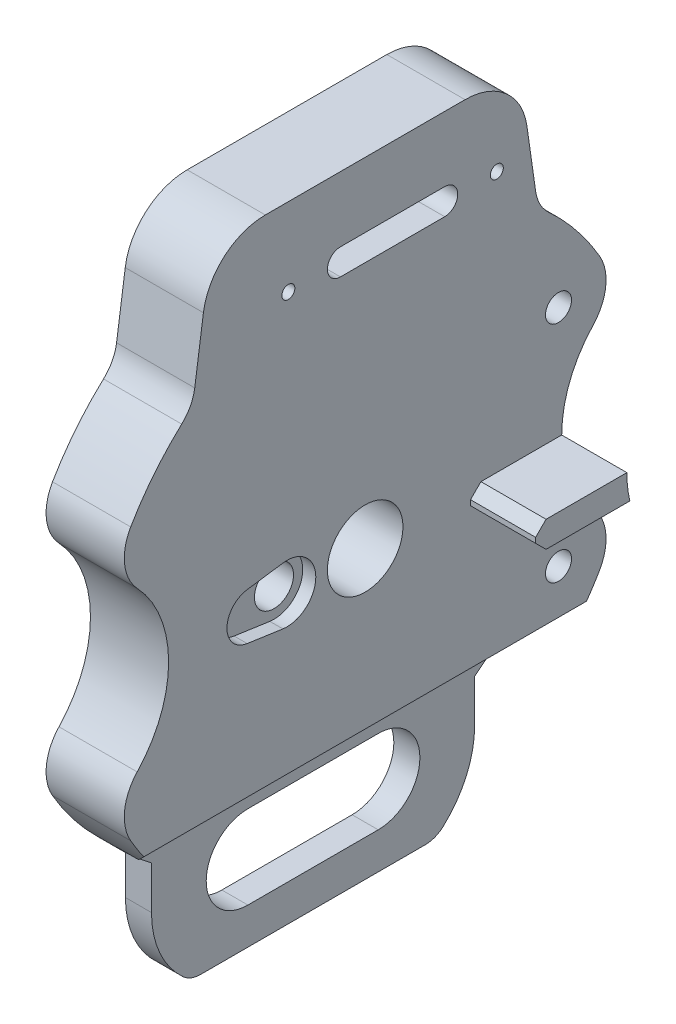
from build123d import *

# Parameters (mm, degrees)
SZKIC1_R                    = 14.5
SZKIC1_R_2                  = 5
DODANIE_WYCI_GNI_CIE1_DEPTH = 15
M6_TAPPED_HOLE1_D           = 5
DODANIE_WYCI_GNI_CIE3_START = -25
DODANIE_WYCI_GNI_CIE3_DEPTH = 25
WYTNIJ_WYCI_GNI_CIE2_DEPTH  = 10
WYTNIJ_WYCI_GNI_CIE4_DEPTH  = 20
SFAZOWANIE4_SIZE            = 10
WYTNIJ_WYCI_GNI_CIE5_DEPTH  = 5
SZKIC17_5_R                 = 7.5
WYTNIJ_WYCI_GNI_CIE6_DEPTH  = 163.311542951


with BuildPart() as part:
    # Szkic1 → Dodanie-wyciągnięcie1 (new, symmetric)
    with BuildSketch(Plane(origin=(0, 0, 0), x_dir=(0, 0, -1), z_dir=(1, 0, 0))):
        with BuildLine():
            Line((62.076569761, 109.385977671), (65.40069858, 86.060032436))
            ThreePointArc((65.40069858, 86.060032436), (67.080888035, 80.867469231), (70.408575711, 76.541704099))
            ThreePointArc((70.408575711, 76.541704099), (81.115709466, 65.086416999), (89.978943384, 52.151603499))
            ThreePointArc((89.978943384, 52.151603499), (92.32041193, 40.919666146), (87.495806927, 30.50995538))
            ThreePointArc((87.495806927, 30.50995538), (75.419960244, 0), (87.495806927, -30.50995538))
            ThreePointArc((87.495806927, -30.50995538), (92.32041193, -40.919666146), (89.978943384, -52.151603499))
            ThreePointArc((89.978943384, -52.151603499), (77.589025222, -69.25274843), (62, -83.498502981))
            Line((62, -83.498502981), (62, -100))
            ThreePointArc((62, -100), (58.828108774, -114.988630917), (49.856267202, -127.407407407))
            ThreePointArc((49.856267202, -127.407407407), (46.738768646, -129.329364235), (43.138357147, -130))
            Line((43.138357147, -130), (25, -130))
            Line((25, -130), (-25, -130))
            Line((-25, -130), (-43.138357147, -130))
            ThreePointArc((-43.138357147, -130), (-46.738768646, -129.329364235), (-49.856267202, -127.407407407))
            ThreePointArc((-49.856267202, -127.407407407), (-58.828108774, -114.988630917), (-62, -100))
            Line((-62, -100), (-62, -83.498502981))
            ThreePointArc((-62, -83.498502981), (-77.589025222, -69.25274843), (-89.978943384, -52.151603499))
            ThreePointArc((-89.978943384, -52.151603499), (-92.32041193, -40.919666146), (-87.495806927, -30.50995538))
            ThreePointArc((-87.495806927, -30.50995538), (-75.419960244, 0), (-87.495806927, 30.50995538))
            ThreePointArc((-87.495806927, 30.50995538), (-92.32041193, 40.919666146), (-89.978943384, 52.151603499))
            ThreePointArc((-89.978943384, 52.151603499), (-81.115709466, 65.086416999), (-70.408575711, 76.541704099))
            ThreePointArc((-70.408575711, 76.541704099), (-67.080888035, 80.867469231), (-65.40069858, 86.060032436))
            Line((-65.40069858, 86.060032436), (-62.076569761, 109.385977671))
            ThreePointArc((-62.076569761, 109.385977671), (-54.044566654, 124.12820267), (-38.316621209, 130))
            Line((-38.316621209, 130), (38.316621209, 130))
            ThreePointArc((38.316621209, 130), (54.044566654, 124.12820267), (62.076569761, 109.385977671))
        make_face()
        Circle(SZKIC1_R, mode=Mode.SUBTRACT)
        with Locations((74.189369185, -43)):
            Circle(SZKIC1_R_2, mode=Mode.SUBTRACT)
        with Locations((74.189369185, 43)):
            Circle(SZKIC1_R_2, mode=Mode.SUBTRACT)
        with BuildLine():
            Line((-25, -84), (25, -84))
            ThreePointArc((25, -84), (41, -100), (25, -116))
            Line((25, -116), (-25, -116))
            ThreePointArc((-25, -116), (-41, -100), (-25, -84))
        make_face(mode=Mode.SUBTRACT)
    extrude(amount=DODANIE_WYCI_GNI_CIE1_DEPTH, both=True)

    # M6 Tapped Hole1 (through all)
    with Locations(Plane(origin=(15, 0, 0), x_dir=(0, 0, -1), z_dir=(1, 0, 0))):
        with Locations((-29.489576473, 100), (50.510423527, 100)):
            Hole(M6_TAPPED_HOLE1_D / 2)

    # Szkic5 → Dodanie-wyciągnięcie3 (add)
    with BuildSketch(Plane.ZY.offset(-15).offset(DODANIE_WYCI_GNI_CIE3_START)):
        with BuildLine():
            Line((-40.419960244, -6), (-44.419960244, -10))
            Line((-44.419960244, -10), (-76.556013712, -10))
            ThreePointArc((-76.556013712, -10), (-75.704884126, -5.032161998), (-75.419960244, 0))
            Line((-75.419960244, 0), (-44.419960244, 0))
            Line((-44.419960244, 0), (-40.419960244, -4))
            Line((-40.419960244, -4), (-40.419960244, -6))
        make_face()
    extrude(amount=DODANIE_WYCI_GNI_CIE3_DEPTH)

    # Szkic12 → Wytnij-wyciągnięcie2 (cut)
    with BuildSketch(Plane(origin=(15, 0, 0), x_dir=(0, 0, -1), z_dir=(1, 0, 0))):
        with BuildLine():
            Line((30.510423527, 105), (-9.489576473, 105))
            ThreePointArc((-9.489576473, 105), (-14.489576473, 100), (-9.489576473, 95))
            Line((-9.489576473, 95), (30.510423527, 95))
            ThreePointArc((30.510423527, 95), (35.510423527, 100), (30.510423527, 105))
        make_face()
    extrude(amount=-WYTNIJ_WYCI_GNI_CIE2_DEPTH, mode=Mode.SUBTRACT)

    # Szkic16 → Wytnij-wyciągnięcie4 (cut)
    with BuildSketch(Plane(origin=(15, 0, 0), x_dir=(0, 0, -1), z_dir=(1, 0, 0))):
        with BuildLine():
            Line((-43.138357147, -130), (43.138357147, -130))
            ThreePointArc((43.138357147, -130), (46.738768646, -129.329364235), (49.856267202, -127.407407407))
            ThreePointArc((49.856267202, -127.407407407), (58.828108774, -114.988630917), (62, -100))
            Line((62, -100), (62, -83.498502981))
            ThreePointArc((62, -83.498502981), (69.784912958, -77.110738056), (76.915538092, -70))
            Line((76.915538092, -70), (-76.915538092, -70))
            ThreePointArc((-76.915538092, -70), (-69.784912958, -77.110738056), (-62, -83.498502981))
            Line((-62, -83.498502981), (-62, -100))
            ThreePointArc((-62, -100), (-58.828108774, -114.988630917), (-49.856267202, -127.407407407))
            ThreePointArc((-49.856267202, -127.407407407), (-46.738768646, -129.329364235), (-43.138357147, -130))
        make_face()
        with BuildLine():
            Line((-25, -116), (25, -116))
            ThreePointArc((25, -116), (41, -100), (25, -84))
            Line((25, -84), (-25, -84))
            ThreePointArc((-25, -84), (-41, -100), (-25, -116))
        make_face(mode=Mode.SUBTRACT)
    extrude(amount=-WYTNIJ_WYCI_GNI_CIE4_DEPTH, mode=Mode.SUBTRACT)

    # Sfazowanie4
    sfazowanie4_edges = [part.edges().sort_by_distance(p)[0] for p in [
        (15, -70, 0),
    ]]
    chamfer(sfazowanie4_edges, length=SFAZOWANIE4_SIZE)

    # Szkic17 → Wytnij-wyciągnięcie5 (cut)
    with BuildSketch(Plane(origin=(15, 0, 0), x_dir=(0, 0, -1), z_dir=(1, 0, 0))):
        with BuildLine():
            Line((-31.578571429, -10.936663672), (-45.292857143, -8.957177035))
            ThreePointArc((-45.292857143, -8.957177035), (-53.050000001, 0), (-45.292857143, 8.957177034))
            Line((-45.292857143, 8.957177034), (-31.578571428, 10.93666367))
            ThreePointArc((-31.578571428, 10.93666367), (-22.462605729, 8.080234378), (-18.98012619, -0.815402484))
            ThreePointArc((-18.98012619, -0.815402484), (-23.079412621, -8.614404817), (-31.578571429, -10.936663672))
        make_face()
    extrude(amount=-WYTNIJ_WYCI_GNI_CIE5_DEPTH, mode=Mode.SUBTRACT)

    # Szkic17<5> → Wytnij-wyciągnięcie6 (cut, through all)
    with BuildSketch(Plane(origin=(15, 0, 0), x_dir=(0, 0, -1), z_dir=(1, 0, 0))):
        with Locations((-30, -1e-09)):
            Circle(SZKIC17_5_R)
    extrude(amount=-WYTNIJ_WYCI_GNI_CIE6_DEPTH, mode=Mode.SUBTRACT)


solid = part.part
